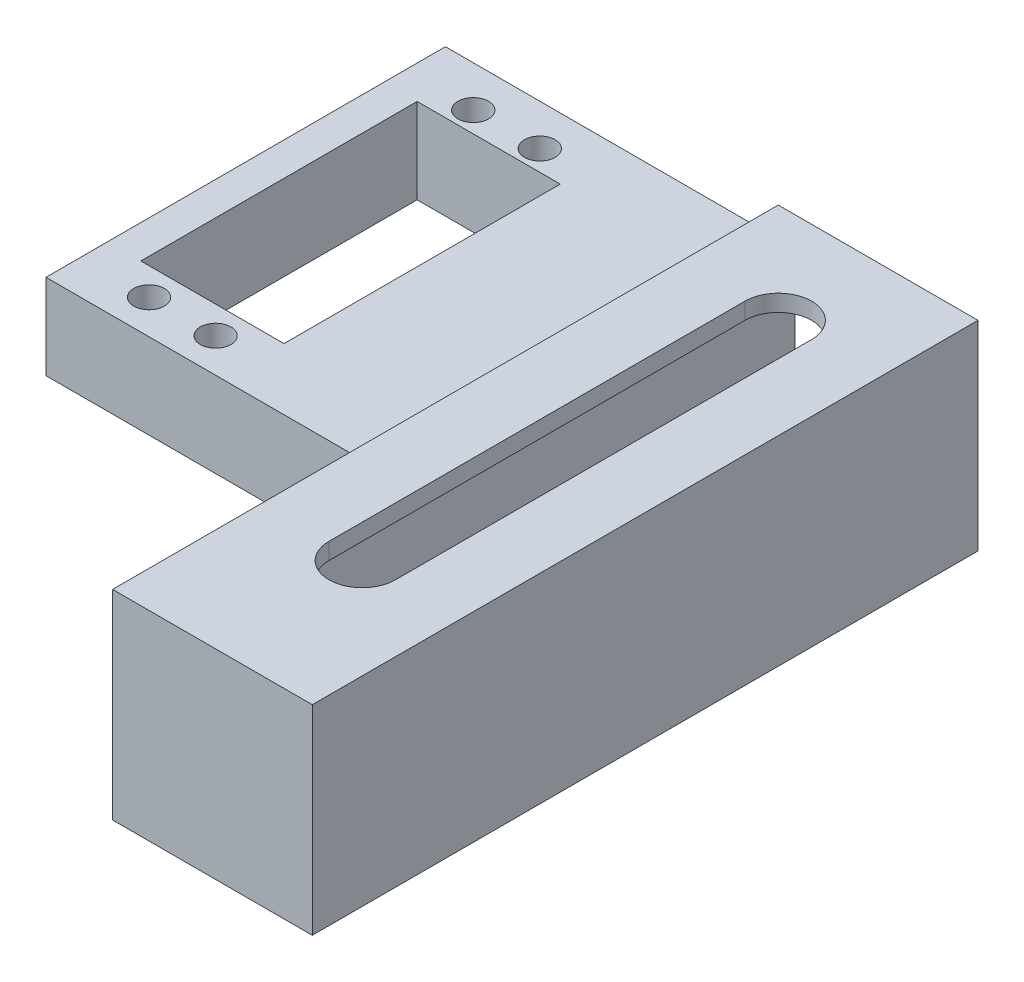
from build123d import *

# Parameters (mm, degrees)
ESQUISSE1_W             = 30
ESQUISSE1_H             = 30
BOSS_EXTRU_1_DEPTH      = 100
ESQUISSE2_W             = 25
ESQUISSE2_H             = 25
ENL_V_MAT_EXTRU_1_DEPTH = 95
ENL_V_MAT_EXTRU_2_DEPTH = 2.5
ESQUISSE4_W             = 60
ESQUISSE4_H             = 25.6
BOSS_EXTRU_2_DEPTH      = 50
ESQUISSE5_W             = 21.5
ESQUISSE5_H             = 41.5
ENL_V_MAT_EXTRU_3_DEPTH = 132.52946438
ESQUISSE6_R             = 2.3
ENL_V_MAT_EXTRU_4_DEPTH = 132.52946438
ESQUISSE9_W             = 50
ESQUISSE9_H             = 12.8
ENL_V_MAT_EXTRU_6_DEPTH = 132.52946438


with BuildPart() as part:
    # Esquisse1 → Boss.-Extru.1 (new body)
    with BuildSketch(Plane.XY):
        with Locations((-15, -15)):
            Rectangle(ESQUISSE1_W, ESQUISSE1_H)
    extrude(amount=BOSS_EXTRU_1_DEPTH)

    # Esquisse2 → Enlèv. mat.-Extru.1 (cut)
    with BuildSketch(Plane(origin=(0, 0, 0), x_dir=(-1, 0, 0), z_dir=(0, 0, -1))):
        with Locations((15, -15)):
            Rectangle(ESQUISSE2_W, ESQUISSE2_H)
    extrude(amount=-ENL_V_MAT_EXTRU_1_DEPTH, mode=Mode.SUBTRACT)

    # Esquisse3 → Enlèv. mat.-Extru.2 (cut)
    with BuildSketch(Plane(origin=(0, 0, 0), x_dir=(1, 0, 0), z_dir=(0, 1, 0))):
        with BuildLine():
            Line((-10, -15), (-10, -77.5))
            ThreePointArc((-10, -77.5), (-15, -82.5), (-20, -77.5))
            Line((-20, -77.5), (-20, -15))
            ThreePointArc((-20, -15), (-15, -10), (-10, -15))
        make_face()
    extrude(amount=-ENL_V_MAT_EXTRU_2_DEPTH, mode=Mode.SUBTRACT)

    # Esquisse4 → Boss.-Extru.2 (add)
    with BuildSketch(Plane.ZY.offset(30)):
        with Locations((30, -17.2)):
            Rectangle(ESQUISSE4_W, ESQUISSE4_H)
    extrude(amount=BOSS_EXTRU_2_DEPTH)

    # Esquisse5 → Enlèv. mat.-Extru.3 (cut, through all)
    with BuildSketch(Plane(origin=(0, 0, 0), x_dir=(1, 0, 0), z_dir=(0, 1, 0))):
        with Locations((-64.25, -30)):
            Rectangle(ESQUISSE5_W, ESQUISSE5_H)
    extrude(amount=-ENL_V_MAT_EXTRU_3_DEPTH, mode=Mode.SUBTRACT)

    # Esquisse6 → Enlèv. mat.-Extru.4 (cut, through all)
    with BuildSketch(Plane(origin=(0, 0, 0), x_dir=(1, 0, 0), z_dir=(0, 1, 0))):
        with Locations(Location((-69.66, -54.86, 0), (0, 0, 270))):
            Circle(ESQUISSE6_R)
        with Locations(Location((-59.66, -54.86, 0), (0, 0, 270))):
            Circle(ESQUISSE6_R)
        with Locations(Location((-69.66, -6.16, 0), (0, 0, 270))):
            Circle(ESQUISSE6_R)
        with Locations(Location((-59.66, -6.16, 0), (0, 0, 270))):
            Circle(ESQUISSE6_R)
    extrude(amount=-ENL_V_MAT_EXTRU_4_DEPTH, mode=Mode.SUBTRACT)

    # Esquisse9 → Enlèv. mat.-Extru.6 (cut, through all)
    with BuildSketch(Plane(origin=(0, 0, 0), x_dir=(-1, 0, 0), z_dir=(0, 0, -1))):
        with Locations((55, -23.6)):
            Rectangle(ESQUISSE9_W, ESQUISSE9_H)
    extrude(amount=-ENL_V_MAT_EXTRU_6_DEPTH, mode=Mode.SUBTRACT)


solid = part.part
